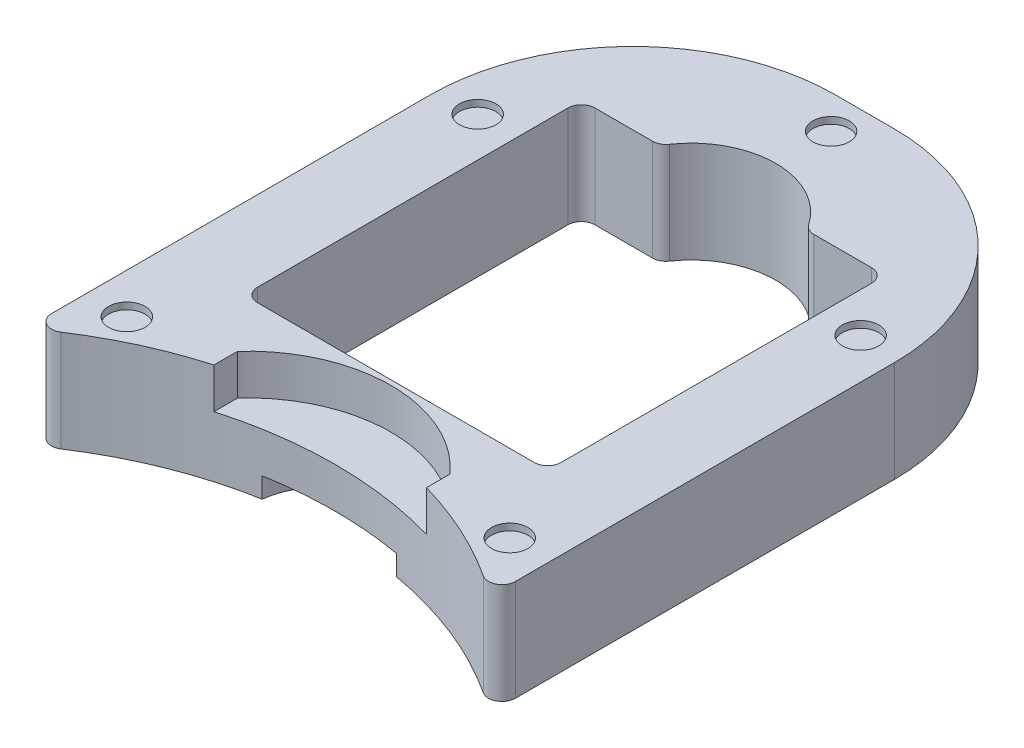
from build123d import *

# Parameters (mm, degrees)
BASE_DEPTH                      = 38.1
SKETCH2_R                       = 8.89
SKETCH2_R_2                     = 10.16
COFFEE_MAKER_FEET_CUTOUTS_DEPTH = 2.54
ASYMMETRIC_FOOT_SLOT_DEPTH      = 2.54
FRONT_START                     = -38.1
SKETCH11_R                      = 25.4
FRONT_CUTOUT_DEPTH              = 7.62
FILLET1_R                       = 76.2
DRIP_START                      = -38.1
DRIP_TRAY_CUTOUT_DEPTH          = 15.24
SKETCH5_R                       = 6.858
FEET_PADS_DEPTH                 = 2.54
CENTER_CUTOUT_DEPTH             = 221.978403371
FILLET2_R                       = 5.08
FILLET4_R                       = 5.08
EASY_PRINTER_RELEASE_TAB_DEPTH  = 10.16


with BuildPart() as part:
    # Sketch1 → Base (new body)
    with BuildSketch(Plane(origin=(0, 0, 0), x_dir=(1, 0, 0), z_dir=(0, 1, 0))):
        with BuildLine():
            Line((-87.3125, 199.39), (-87.3125, -29.21))
            ThreePointArc((-87.3125, -29.21), (0, 0), (87.3125, -29.21))
            Line((87.3125, -29.21), (87.3125, 199.39))
            Line((87.3125, 199.39), (-87.3125, 199.39))
        make_face()
    extrude(amount=BASE_DEPTH)

    # Sketch2 → Coffee Maker Feet Cutouts (cut)
    with BuildSketch(Plane(origin=(0, 0, 0), x_dir=(-1, 0, 0), z_dir=(0, -1, 0))):
        with Locations(Location((71.834375, 8.89, 0), (0, 0, 90))):
            Circle(SKETCH2_R)
        with Locations(Location((74.549, 108.712, 0), (0, 0, 90))):
            Circle(SKETCH2_R_2)
        with Locations(Location((-74.549, 108.712, 0), (0, 0, 90))):
            Circle(SKETCH2_R_2)
        with Locations(Location((-71.834375, 8.89, 0), (0, 0, 90))):
            Circle(SKETCH2_R)
        with BuildLine():
            Line((-43.994090512, 159.512), (-32.995567884, 153.162))
            ThreePointArc((-32.995567884, 153.162), (0, 172.212), (32.995567884, 153.162))
            Line((32.995567884, 153.162), (43.994090512, 159.512))
            ThreePointArc((43.994090512, 159.512), (0, 184.912), (-43.994090512, 159.512))
        make_face()
    extrude(amount=-COFFEE_MAKER_FEET_CUTOUTS_DEPTH, mode=Mode.SUBTRACT)

    # Sketch10 → Asymmetric Foot Slot (cut)
    with BuildSketch(Plane(origin=(0, 0, 0), x_dir=(-1, 0, 0), z_dir=(0, -1, 0))):
        with BuildLine():
            Line((-84.709, 108.712), (-84.709, 116.332))
            ThreePointArc((-84.709, 116.332), (-74.549, 126.492), (-64.389, 116.332))
            Line((-64.389, 116.332), (-64.389, 108.712))
            ThreePointArc((-64.389, 108.712), (-74.549, 98.552), (-84.709, 108.712))
        make_face()
    extrude(amount=-ASYMMETRIC_FOOT_SLOT_DEPTH, mode=Mode.SUBTRACT)

    # Sketch11 → Front cutout (cut)
    with BuildSketch(Plane(origin=(0, 38.1, 0), x_dir=(1, 0, 0), z_dir=(0, 1, 0)).offset(FRONT_START)):
        with Locations((0, -5.08)):
            Circle(SKETCH11_R)
    extrude(amount=FRONT_CUTOUT_DEPTH, mode=Mode.SUBTRACT)

    # Fillet1
    fillet1_edges = [part.edges().sort_by_distance(p)[0] for p in [
        (87.3125, 19.05, -199.39),
        (-87.3125, 19.05, -199.39),
    ]]
    fillet(fillet1_edges, radius=FILLET1_R)

    # Sketch4 → Drip Tray Cutout (cut)
    with BuildSketch(Plane.XZ.offset(DRIP_START)):
        with BuildLine():
            Line((40.005, -3.26616737), (40.005, 5.62383263))
            Line((40.005, 5.62383263), (-40.005, 5.62383263))
            Line((-40.005, 5.62383263), (-40.005, -3.26616737))
            ThreePointArc((-40.005, -3.26616737), (0, -21.04616737), (40.005, -3.26616737))
        make_face()
    extrude(amount=DRIP_TRAY_CUTOUT_DEPTH, mode=Mode.SUBTRACT)

    # Sketch5 → Feet Pads (cut)
    with BuildSketch(Plane(origin=(0, 38.1, 0), x_dir=(1, 0, 0), z_dir=(0, 1, 0))):
        with Locations(Location((-72.0725, -6.35, 0), (0, 0, 270))):
            Circle(SKETCH5_R)
        with Locations(Location((-72.0725, 125.73, 0), (0, 0, 270))):
            Circle(SKETCH5_R)
        with Locations(Location((0, 186.69, 0), (0, 0, 270))):
            Circle(SKETCH5_R)
        with Locations(Location((72.0725, 125.73, 0), (0, 0, 90))):
            Circle(SKETCH5_R)
        with Locations(Location((72.0725, -6.35, 0), (0, 0, 90))):
            Circle(SKETCH5_R)
    extrude(amount=-FEET_PADS_DEPTH, mode=Mode.SUBTRACT)

    # Sketch6 → Center cutout (cut, through all)
    with BuildSketch(Plane(origin=(0, 0, 0), x_dir=(-1, 0, 0), z_dir=(0, -1, 0))):
        with BuildLine():
            Line((27.569240033, 149.86), (57.15, 149.86))
            Line((57.15, 149.86), (57.15, 22.86))
            Line((57.15, 22.86), (-57.15, 22.86))
            Line((-57.15, 22.86), (-57.15, 149.86))
            Line((-57.15, 149.86), (-27.569240033, 149.86))
            ThreePointArc((-27.569240033, 149.86), (0, 165.862), (27.569240033, 149.86))
        make_face()
    extrude(amount=-CENTER_CUTOUT_DEPTH, mode=Mode.SUBTRACT)

    # Fillet2
    fillet2_edges = [part.edges().sort_by_distance(p)[0] for p in [
        (57.15, 19.05, -22.86),
        (57.15, 19.05, -149.86),
        (27.569240033, 19.05, -149.86),
        (-27.569240033, 19.05, -149.86),
        (-57.15, 19.05, -149.86),
        (-57.15, 19.05, -22.86),
    ]]
    fillet(fillet2_edges, radius=FILLET2_R)

    # Fillet4
    fillet4_edges = [part.edges().sort_by_distance(p)[0] for p in [
        (87.3125, 19.05, 29.21),
        (-87.3125, 19.05, 29.21),
    ]]
    fillet(fillet4_edges, radius=FILLET4_R)

    # Sketch9 → Easy-Printer-Release-Tab (cut, symmetric)
    with BuildSketch(Plane(origin=(0, 0, 0), x_dir=(0, 0, -1), z_dir=(1, 0, 0))):
        Polygon((199.39, 5.08), (189.23, 0), (199.39, 0), align=None)
    extrude(amount=EASY_PRINTER_RELEASE_TAB_DEPTH, both=True, mode=Mode.SUBTRACT)


solid = part.part
